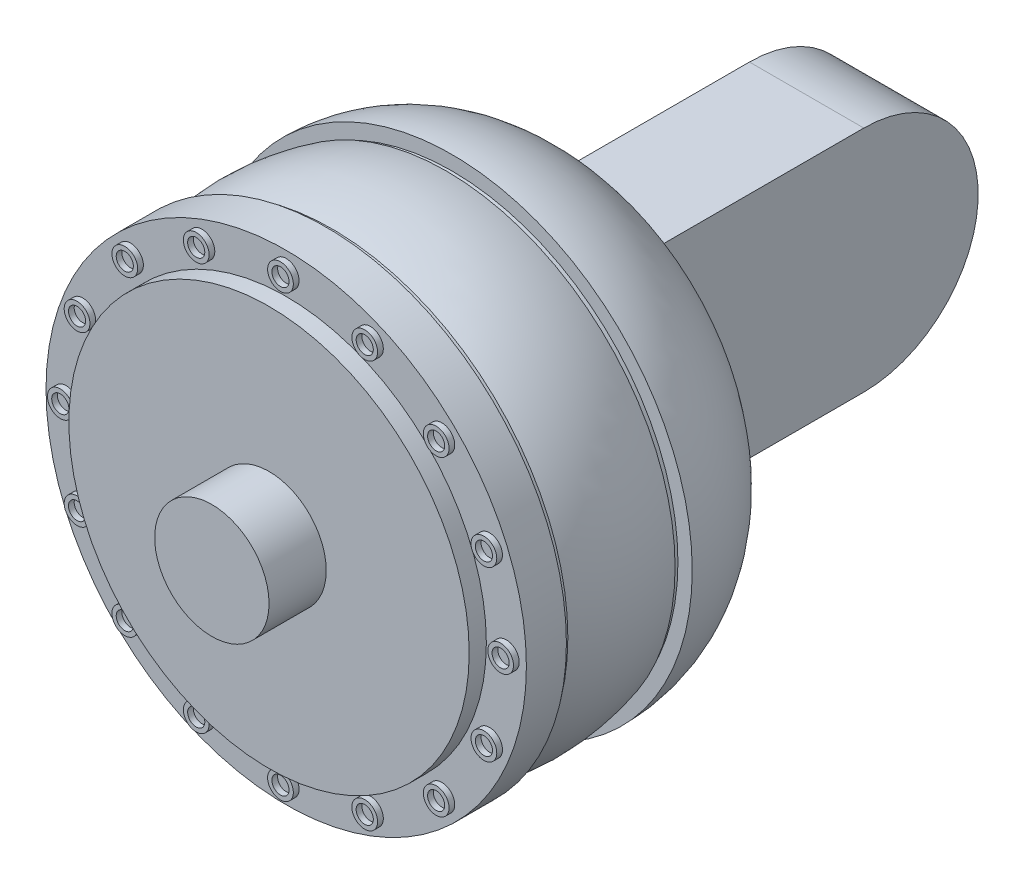
from build123d import *

# Parameters (mm, degrees)
SKETCH2_R            = 39.5
BOSS_EXTRUDE1_DEPTH  = 1
SKETCH4_R            = 41.25
BOSS_EXTRUDE2_DEPTH  = 1
SKETCH5_R            = 42
BOSS_EXTRUDE3_DEPTH  = 7
SKETCH6_R            = 35
BOSS_EXTRUDE4_DEPTH  = 3
SKETCH8_R            = 2.25
SKETCH8_R_2          = 1.5
BOSS_EXTRUDE5_DEPTH  = 1
CIRPATTERN1_COUNT    = 16
SKETCH9_W            = 20
SKETCH9_H            = 40
BOSS_EXTRUDE6_DEPTH  = 42
SKETCH10_R           = 20
BOSS_EXTRUDE7_DEPTH  = 20
SKETCH11_R           = 10
BOSS_EXTRUDE8_DEPTH  = 10
SKETCH12_R           = 10
BOSS_EXTRUDE10_DEPTH = 10


with BuildPart() as part:
    # Sketch1 → Revolve1 (revolve)
    with BuildSketch(Plane(origin=(0, 0, 0), x_dir=(1, 0, 0), z_dir=(0, 1, 0))):
        with BuildLine():
            Line((0, 0), (0, -20))
            Line((0, -20), (-42, -20))
            ThreePointArc((-42, -20), (-39.360679775, -8.819660113), (-32, 0))
            Line((-32, 0), (0, 0))
        make_face()
    revolve(axis=Axis((0, 0, 0), (0, 0, 1)))

    # Sketch2 → Boss-Extrude1 (add)
    with BuildSketch(Plane.XY.offset(20)):
        Circle(SKETCH2_R)
    extrude(amount=BOSS_EXTRUDE1_DEPTH)

    # Sketch3 → Revolve2 (revolve)
    with BuildSketch(Plane(origin=(0, 0, 0), x_dir=(1, 0, 0), z_dir=(0, 1, 0))):
        with BuildLine():
            Line((0, -21), (-40, -21))
            ThreePointArc((-40, -21), (-41.376973739, -31), (-40, -41))
            Line((-40, -41), (0, -41))
            Line((0, -41), (0, -21))
        make_face()
    revolve(axis=Axis((0, 0, 21), (0, 0, 1)))

    # Sketch4 → Boss-Extrude2 (add)
    with BuildSketch(Plane.XY.offset(41)):
        Circle(SKETCH4_R)
    extrude(amount=BOSS_EXTRUDE2_DEPTH)

    # Sketch5 → Boss-Extrude3 (add)
    with BuildSketch(Plane.XY.offset(42)):
        Circle(SKETCH5_R)
    extrude(amount=BOSS_EXTRUDE3_DEPTH)

    # Sketch6 → Boss-Extrude4 (add)
    with BuildSketch(Plane.XY.offset(49)):
        Circle(SKETCH6_R)
    extrude(amount=BOSS_EXTRUDE4_DEPTH)

    # Sketch8 → Boss-Extrude5 (add)
    with BuildSketch(Plane.XY.offset(49)):
        with Locations((38.5, 0)):
            Circle(SKETCH8_R)
        with Locations((38.5, 0)):
            Circle(SKETCH8_R_2, mode=Mode.SUBTRACT)
    boss_extrude5 = extrude(amount=BOSS_EXTRUDE5_DEPTH)

    # CirPattern1: Boss-Extrude5 ×16 about axis
    cirpattern1_axis = Axis((0, 0, 0), (0, 0, 1))
    for i in range(1, CIRPATTERN1_COUNT):
        add(boss_extrude5.rotate(cirpattern1_axis, i * 360 / CIRPATTERN1_COUNT))

    # Sketch9 → Boss-Extrude6 (add)
    with BuildSketch(Plane(origin=(0, 0, 0), x_dir=(-1, 0, 0), z_dir=(0, 0, -1))):
        Rectangle(SKETCH9_W, SKETCH9_H)
    extrude(amount=BOSS_EXTRUDE6_DEPTH)

    # Sketch10 → Boss-Extrude7 (add)
    with BuildSketch(Plane.ZY.offset(10)):
        with Locations((-42, 0)):
            Circle(SKETCH10_R)
    extrude(amount=-BOSS_EXTRUDE7_DEPTH)

    # Sketch11 → Boss-Extrude8 (add)
    with BuildSketch(Plane.ZY.offset(10)):
        with Locations(Location((-42, 0, 0), (0, 0, 180))):
            Circle(SKETCH11_R)
    extrude(amount=BOSS_EXTRUDE8_DEPTH)

    # Sketch12 → Boss-Extrude10 (add)
    with BuildSketch(Plane.XY.offset(52)):
        Circle(SKETCH12_R)
    extrude(amount=BOSS_EXTRUDE10_DEPTH)


solid = part.part
